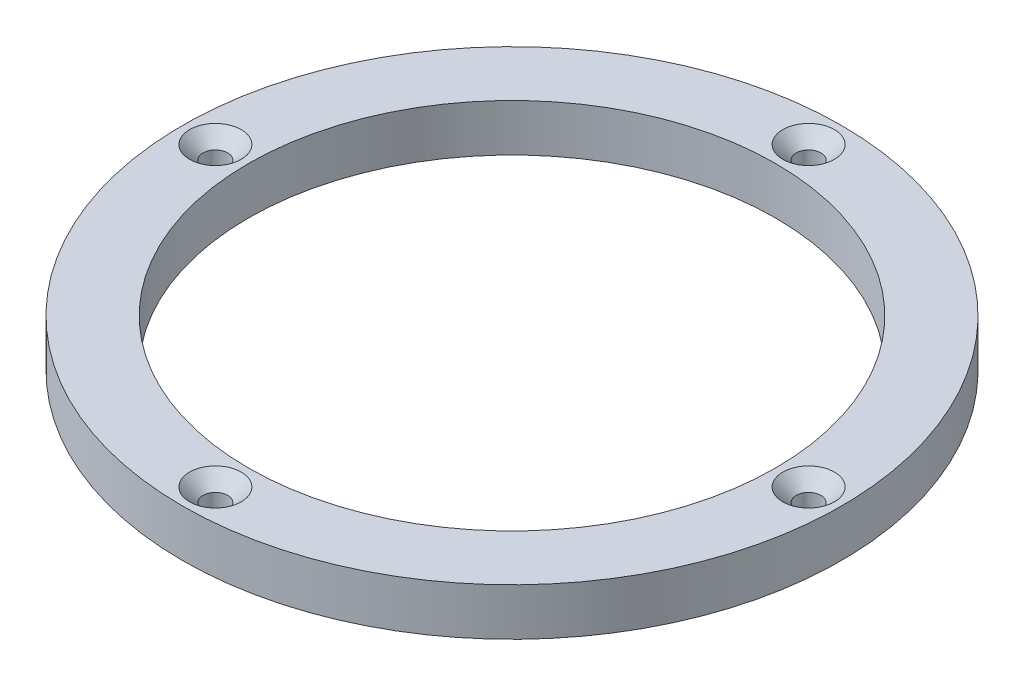
from build123d import *

# Parameters (mm, degrees)
SKETCH1_R                                       = 60
SKETCH1_R_2                                     = 48
BOSS_EXTRUDE1_DEPTH                             = 8.6
CSK_FOR_M4_FLAT_HEAD_MACHINE_SCREW1_D           = 4.5
CSK_FOR_M4_FLAT_HEAD_MACHINE_SCREW1_CSINK_D     = 9.4
CSK_FOR_M4_FLAT_HEAD_MACHINE_SCREW1_CSINK_ANGLE = 90


with BuildPart() as part:
    # Sketch1 → Boss-Extrude1 (new body)
    with BuildSketch(Plane(origin=(0, 0, 0), x_dir=(1, 0, 0), z_dir=(0, 1, 0))):
        Circle(SKETCH1_R)
        Circle(SKETCH1_R_2, mode=Mode.SUBTRACT)
    extrude(amount=BOSS_EXTRUDE1_DEPTH)

    # CSK for M4 Flat Head Machine Screw1 (through all)
    with Locations(Plane(origin=(0, 8.6, 0), x_dir=(1, 0, 0), z_dir=(0, 1, 0))):
        with Locations((0, 54), (0, -54), (-54, 0), (54, 0)):
            CounterSinkHole(CSK_FOR_M4_FLAT_HEAD_MACHINE_SCREW1_D / 2, CSK_FOR_M4_FLAT_HEAD_MACHINE_SCREW1_CSINK_D / 2, counter_sink_angle=CSK_FOR_M4_FLAT_HEAD_MACHINE_SCREW1_CSINK_ANGLE)


solid = part.part
